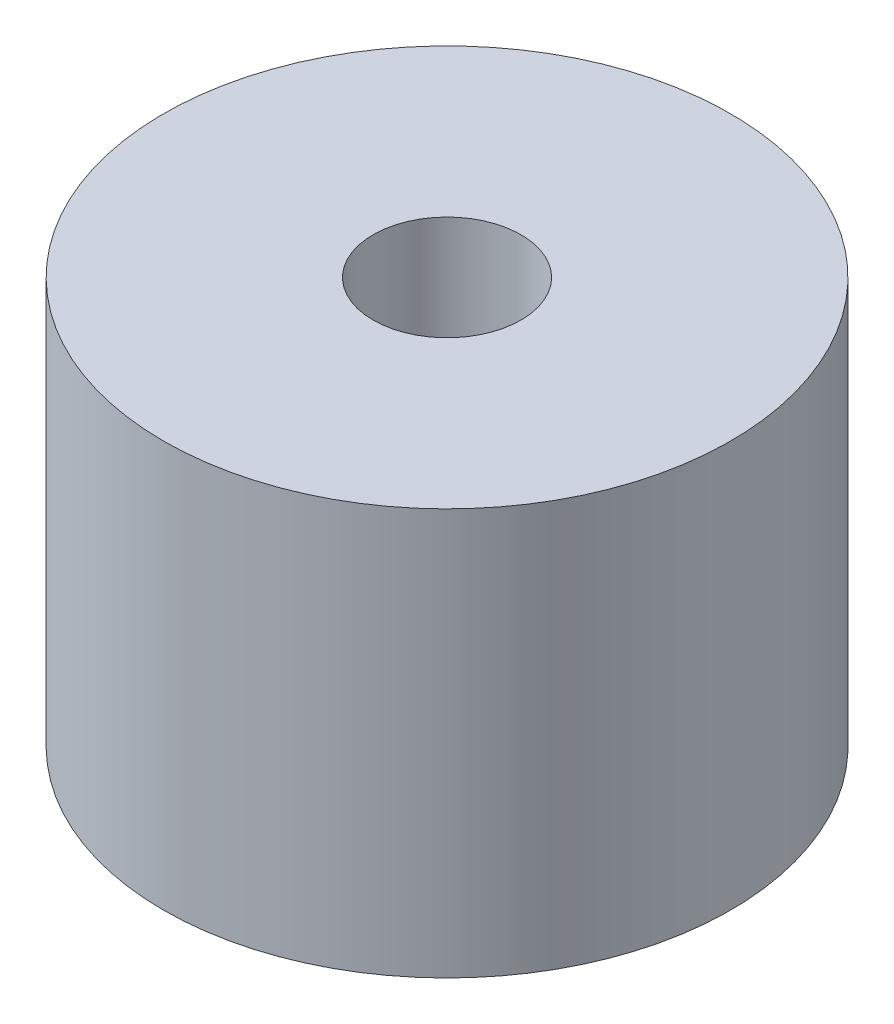
from build123d import *

# Parameters (mm, degrees)
SKETCH1_R           = 5.75
SKETCH1_R_2         = 1.5
BOSS_EXTRUDE1_DEPTH = 8.24


with BuildPart() as part:
    # Sketch1 → Boss-Extrude1 (new body)
    with BuildSketch(Plane(origin=(0, 0, 0), x_dir=(1, 0, 0), z_dir=(0, 1, 0))):
        with Locations(Location((0, 0, 0), (0, 0, 270))):
            Circle(SKETCH1_R)
        with Locations(Location((0, 0, 0), (0, 0, 270))):
            Circle(SKETCH1_R_2, mode=Mode.SUBTRACT)
    extrude(amount=BOSS_EXTRUDE1_DEPTH)


solid = part.part
